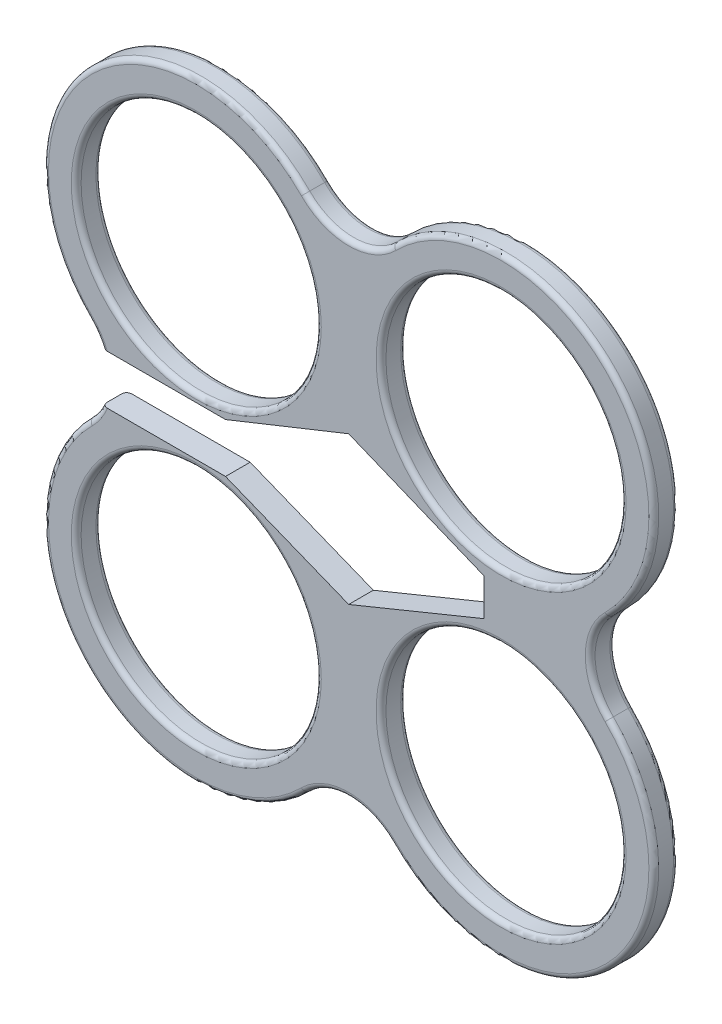
from build123d import *

# Parameters (mm, degrees)
ESQUISSE1_R        = 97.5
BOSS_EXTRU_1_DEPTH = 10
CONG_1_R           = 4


with BuildPart() as part:
    # Esquisse1 → Boss.-Extru.1 (new, symmetric)
    with BuildSketch(Plane.XY):
        with BuildLine():
            Line((-200.243315513, 20), (-100, 20))
            Line((-100, 20), (0, 60))
            Line((0, 60), (110, 15))
            Line((110, 15), (110, 0))
            Line((110, 0), (110, -15))
            Line((110, -15), (0, -60))
            Line((0, -60), (-100, -20))
            Line((-100, -20), (-200.243315513, -20))
            ThreePointArc((-200.243315513, -20), (-204.840142521, -28.287370608), (-210.918099544, -35.558530663))
            ThreePointArc((-210.918099544, -35.558530663), (-211.424927575, -211.424927575), (-35.558530663, -210.918099544))
            ThreePointArc((-35.558530663, -210.918099544), (0, -196.069072462), (35.558530663, -210.918099544))
            ThreePointArc((35.558530663, -210.918099544), (211.424927575, -211.424927575), (210.918099544, -35.558530663))
            ThreePointArc((210.918099544, -35.558530663), (196.069072462, 0), (210.918099544, 35.558530663))
            ThreePointArc((210.918099544, 35.558530663), (211.424927575, 211.424927575), (35.558530663, 210.918099544))
            ThreePointArc((35.558530663, 210.918099544), (0, 196.069072462), (-35.558530663, 210.918099544))
            ThreePointArc((-35.558530663, 210.918099544), (-211.424927575, 211.424927575), (-210.918099544, 35.558530663))
            ThreePointArc((-210.918099544, 35.558530663), (-204.840142521, 28.287370608), (-200.243315513, 20))
        make_face()
        with Locations((123.743686708, 123.743686708)):
            Circle(ESQUISSE1_R, mode=Mode.SUBTRACT)
        with Locations((-123.743686708, 123.743686708)):
            Circle(ESQUISSE1_R, mode=Mode.SUBTRACT)
        with Locations((-123.743686708, -123.743686708)):
            Circle(ESQUISSE1_R, mode=Mode.SUBTRACT)
        with Locations((123.743686708, -123.743686708)):
            Circle(ESQUISSE1_R, mode=Mode.SUBTRACT)
    extrude(amount=BOSS_EXTRU_1_DEPTH, both=True)

    # Congé1
    cong_1_edges = [part.edges().sort_by_distance(p)[0] for p in [
        (0, 196.069072462, 10),
        (-211.424927575, 211.424927575, 10),
        (211.424927575, -211.424927575, -10),
        (0, -196.069072462, -10),
        (-211.424927575, -211.424927575, -10),
        (-204.840142521, 28.287370608, 10),
        (-204.840142521, -28.287370608, -10),
        (-204.840142521, 28.287370608, -10),
        (-211.424927575, 211.424927575, -10),
        (0, 196.069072462, -10),
        (211.424927575, 211.424927575, -10),
        (196.069072462, 0, -10),
        (196.069072462, 0, 10),
        (26.243686708, 123.743686708, -10),
        (26.243686708, 123.743686708, 10),
        (-204.840142521, -28.287370608, 10),
        (-221.243686708, -123.743686708, -10),
        (-221.243686708, -123.743686708, 10),
        (-211.424927575, -211.424927575, 10),
        (-221.243686708, 123.743686708, -10),
        (0, -196.069072462, 10),
        (-221.243686708, 123.743686708, 10),
        (211.424927575, -211.424927575, 10),
        (26.243686708, -123.743686708, -10),
        (26.243686708, -123.743686708, 10),
        (211.424927575, 211.424927575, 10),
    ]]
    fillet(cong_1_edges, radius=CONG_1_R)


solid = part.part
